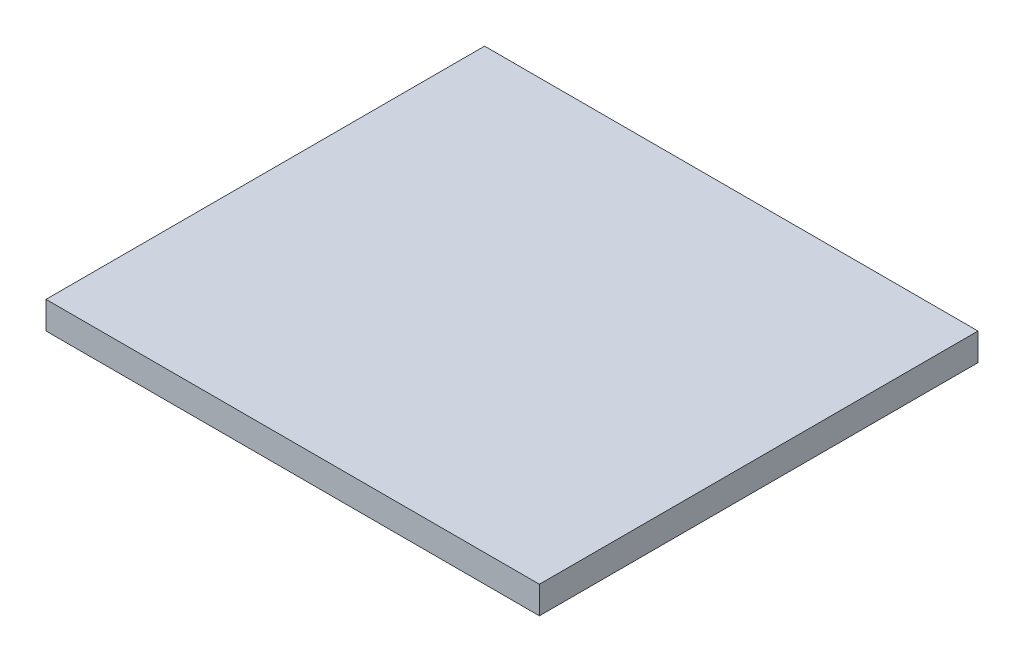
from build123d import *

# Parameters (mm, degrees)
ESQUISSE1_W        = 90
ESQUISSE1_H        = 5
BOSS_EXTRU_1_DEPTH = 80


with BuildPart() as part:
    # Esquisse1 → Boss.-Extru.1 (new body)
    with BuildSketch(Plane.XY):
        Rectangle(ESQUISSE1_W, ESQUISSE1_H)
    extrude(amount=BOSS_EXTRU_1_DEPTH)


solid = part.part
